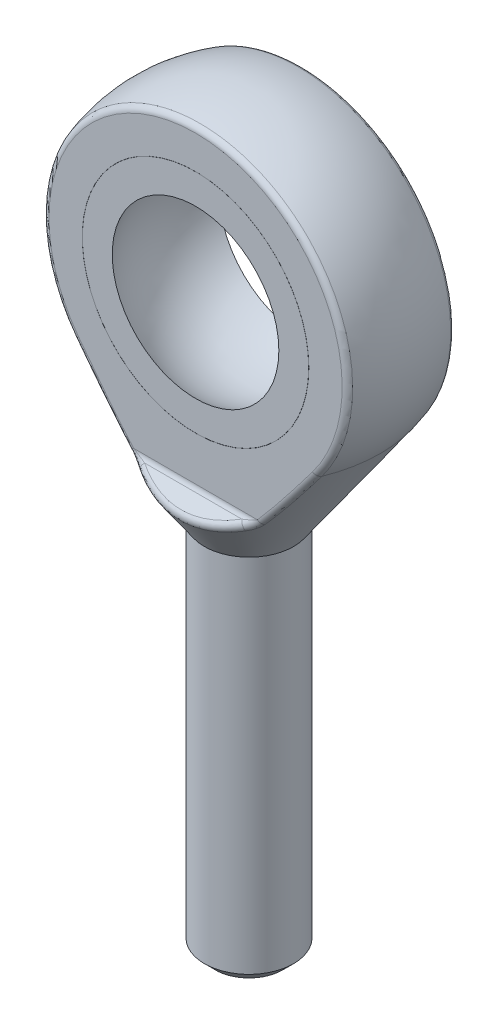
from build123d import *

# Parameters (mm, degrees)
CUT_HEAD_DEPTH      = 36.369478368
CUT_HEAD_DEPTH_BACK = 36.369478368
COSMETIC_FILLET_R   = 0.36


with BuildPart() as part:
    # Sketch2 → Body (revolve)
    with BuildSketch(Plane.XY):
        Polygon((0, -9), (2.5, -9), (2.5, -32.393782217), (1.893782217, -33), (0, -33), align=None)
    revolve(axis=Axis((0, -33, 0), (0, 1, 0)))

    # Sketch20 → Head (revolve)
    with BuildSketch(Plane.XY, mode=Mode.PRIVATE) as head_sk:
        with BuildLine():
            Line((-2.5, -12.120651144), (-7.372368399, -5.162187927))
            ThreePointArc((-7.372368399, -5.162187927), (-7.983097499, 4.155737519), (0, 9))
            Line((0, 9), (0, 5.555))
            ThreePointArc((0, 5.555), (-5.555, 0), (0, -5.555))
            Line((0, -5.555), (0, -12.120651144))
            Line((0, -12.120651144), (-2.5, -12.120651144))
        make_face()
    revolve(head_sk.sketch.rotate(Axis((0, -12.120651144, 0), (0, 1, 0)), 180), axis=Axis((0, -12.120651144, 0), (0, 1, 0)))

    # Sketch23 → Cut-Head (cut, two sides: drawn at the far end of the back side and taken through both)
    with BuildSketch(Plane(origin=(0, 0, 0), x_dir=(0, 0, -1), z_dir=(1, 0, 0)).offset(-CUT_HEAD_DEPTH_BACK)):
        Polygon((6.719047212, -12.120651144), (3, -9), (3, 9), (24.120651144, 9), (24.120651144, -12.120651144), align=None)
        Polygon((-6.719047212, -12.120651144), (-24.120651144, -12.120651144), (-24.120651144, 9), (-3, 9), (-3, -9), align=None)
    extrude(amount=CUT_HEAD_DEPTH + CUT_HEAD_DEPTH_BACK, mode=Mode.SUBTRACT)

    # Sketch25 → cut-sealing (revolve, cut)
    with BuildSketch(Plane(origin=(0, 0, 0), x_dir=(0, 0, -1), z_dir=(1, 0, 0)), mode=Mode.PRIVATE) as cut_sealing_sk:
        with BuildLine():
            Line((-3, 6.358847577), (-3, 4.675256677))
            ThreePointArc((-3, 4.675256677), (-2.852952435, 4.766412425), (-2.7031375, 4.852944741))
            Line((-2.7031375, 4.852944741), (-2.7031375, 6.358847577))
            Line((-2.7031375, 6.358847577), (-3, 6.358847577))
        make_face()
        with BuildLine():
            Line((2.7031375, 6.358847577), (2.7031375, 4.852944741))
            ThreePointArc((2.7031375, 4.852944741), (2.852952435, 4.766412425), (3, 4.675256677))
            Line((3, 4.675256677), (3, 6.358847577))
            Line((3, 6.358847577), (2.7031375, 6.358847577))
        make_face()
    revolve(cut_sealing_sk.sketch.rotate(Axis((0, 0, 4.960647639), (0, 0, -1)), 90), axis=Axis((0, 0, 4.960647639), (0, 0, -1)), mode=Mode.SUBTRACT)

    # Sketch26 → body-sealing (revolve)
    with BuildSketch(Plane(origin=(0, 0, 0), x_dir=(0, 0, -1), z_dir=(1, 0, 0)), mode=Mode.PRIVATE) as body_sealing_sk:
        with BuildLine():
            Line((-2.994818246, 6.358847577), (-3, 6.353665823))
            Line((-3, 6.353665823), (-3, 4.675256677))
            ThreePointArc((-3, 4.675256677), (-2.852952435, 4.766412425), (-2.7031375, 4.852944741))
            Line((-2.7031375, 4.852944741), (-2.7031375, 6.358847577))
            Line((-2.7031375, 6.358847577), (-2.994818246, 6.358847577))
        make_face()
        with BuildLine():
            Line((3, 6.353665823), (3, 4.675256677))
            ThreePointArc((3, 4.675256677), (2.852952435, 4.766412425), (2.7031375, 4.852944741))
            Line((2.7031375, 4.852944741), (2.7031375, 6.358847577))
            Line((2.7031375, 6.358847577), (2.994818246, 6.358847577))
            Line((2.994818246, 6.358847577), (3, 6.353665823))
        make_face()
    revolve(body_sealing_sk.sketch.rotate(Axis((0, 0, 4.960647639), (0, 0, -1)), 90), axis=Axis((0, 0, 4.960647639), (0, 0, -1)))

    # Cosmetic-Fillet
    cosmetic_fillet_edges = [part.edges().sort_by_distance(p)[0] for p in [
        (0, -9.890664944, -4.061453147),
        (0, 8.485281374, -3),
        (-5.204248585, -7.112117738, -3),
        (0, -9, -3),
        (5.204248585, -7.112117738, -3),
        (0, -9.890664944, 4.061453147),
        (0, -9, 3),
        (0, 8.485281374, 3),
        (5.204248585, -7.112117738, 3),
        (-5.204248585, -7.112117738, 3),
    ]]
    fillet(cosmetic_fillet_edges, radius=COSMETIC_FILLET_R)


solid = part.part
